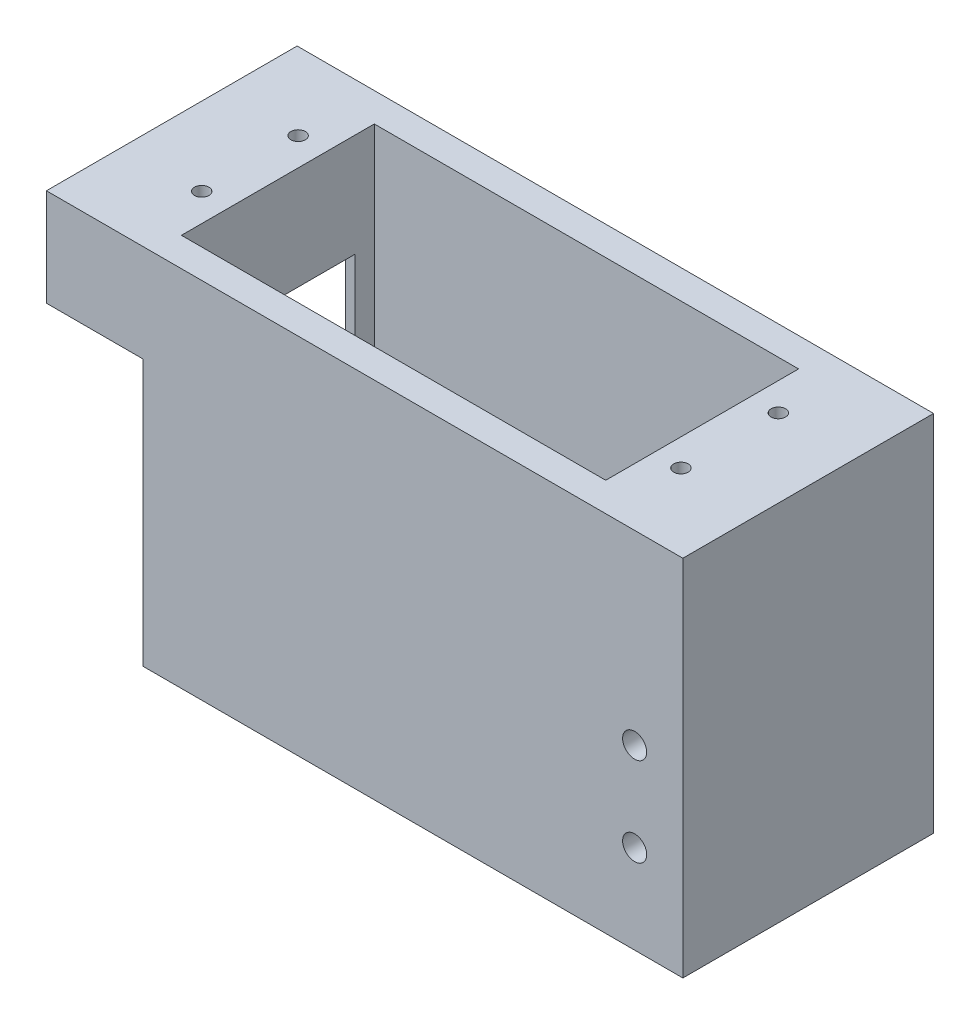
from build123d import *

# Parameters (mm, degrees)
SKETCH1_W                 = 46
SKETCH1_H                 = 26
BOSS_EXTRUDE1_DEPTH       = 27.6
SKETCH2_W                 = 66
SKETCH2_H                 = 26
BOSS_EXTRUDE2_DEPTH       = 10.1
SKETCH3_W                 = 40
SKETCH3_H                 = 20
CUT_EXTRUDE2_DEPTH        = 25.5
F_1_5MM_DOWEL_HOLE2_D     = 1.5
F_1_5MM_DOWEL_HOLE2_DEPTH = 9
F_1_5MM_DOWEL_HOLE2_TIP   = 0.450645464
SKETCH8_W                 = 40
SKETCH8_H                 = 20
CUT_EXTRUDE6_DEPTH        = 3
SKETCH7_W                 = 16
SKETCH7_H                 = 15
CUT_EXTRUDE8_DEPTH        = 3
SKETCH9_R                 = 10.9
CUT_EXTRUDE9_DEPTH        = 7
SKETCH10_W                = 44
SKETCH10_H                = 20
CUT_EXTRUDE10_DEPTH       = 28.5
SKETCH11_W                = 26
SKETCH11_H                = 27.6
BOSS_EXTRUDE3_DEPTH       = 10
F_2_5MM_DOWEL_HOLE1_D     = 2.5
F_2_5MM_DOWEL_HOLE1_DEPTH = 26
F_2_5MM_DOWEL_HOLE1_TIP   = 0.751075774
F_2_5MM_DOWEL_HOLE2_D     = 2.5
F_2_5MM_DOWEL_HOLE2_DEPTH = 9
F_2_5MM_DOWEL_HOLE2_TIP   = 0.751075774


with BuildPart() as part:
    # Sketch1 → Boss-Extrude1 (new body)
    with BuildSketch(Plane(origin=(0, 0, 0), x_dir=(1, 0, 0), z_dir=(0, 1, 0))):
        with Locations((23, 13)):
            Rectangle(SKETCH1_W, SKETCH1_H)
    extrude(amount=BOSS_EXTRUDE1_DEPTH)

    # Sketch2 → Boss-Extrude2 (add)
    with BuildSketch(Plane(origin=(0, 27.6, 0), x_dir=(1, 0, 0), z_dir=(0, 1, 0))):
        with Locations((23, 13)):
            Rectangle(SKETCH2_W, SKETCH2_H)
    extrude(amount=BOSS_EXTRUDE2_DEPTH)

    # Sketch3 → Cut-Extrude2 (cut)
    with BuildSketch(Plane(origin=(0, 37.7, 0), x_dir=(1, 0, 0), z_dir=(0, 1, 0))):
        with Locations((23, 13)):
            Rectangle(SKETCH3_W, SKETCH3_H)
    extrude(amount=-CUT_EXTRUDE2_DEPTH, mode=Mode.SUBTRACT)

    # Ø1.5mm Dowel Hole2
    with Locations(Plane(origin=(-1.9, 37.7, -18), x_dir=(0, 0, 1), z_dir=(0, 1, 0))):
        with Locations((0, 0), (10, 0), (10, 49.7), (0, 49.8)):
            Hole(F_1_5MM_DOWEL_HOLE2_D / 2, depth=F_1_5MM_DOWEL_HOLE2_DEPTH)
            with Locations((0, 0, -(F_1_5MM_DOWEL_HOLE2_DEPTH + F_1_5MM_DOWEL_HOLE2_TIP / 2))):  # 118° drill point
                Cone(0, F_1_5MM_DOWEL_HOLE2_D / 2, F_1_5MM_DOWEL_HOLE2_TIP, mode=Mode.SUBTRACT)

    # Sketch8 → Cut-Extrude6 (cut)
    with BuildSketch(Plane(origin=(0, 12.2, 0), x_dir=(1, 0, 0), z_dir=(0, 1, 0))):
        with Locations((23, 13)):
            Rectangle(SKETCH8_W, SKETCH8_H)
    extrude(amount=-CUT_EXTRUDE6_DEPTH, mode=Mode.SUBTRACT)

    # Sketch7 → Cut-Extrude8 (cut)
    with BuildSketch(Plane.ZY):
        with Locations((-13, 19.5)):
            Rectangle(SKETCH7_W, SKETCH7_H)
    extrude(amount=-CUT_EXTRUDE8_DEPTH, mode=Mode.SUBTRACT)

    # Sketch9 → Cut-Extrude9 (cut)
    with BuildSketch(Plane(origin=(0, 0, 0), x_dir=(-1, 0, 0), z_dir=(0, -1, 0))):
        with Locations(Location((-13.05, 13, 0), (0, 0, 90))):
            Circle(SKETCH9_R)
    extrude(amount=-CUT_EXTRUDE9_DEPTH, mode=Mode.SUBTRACT)

    # Sketch10 → Cut-Extrude10 (cut)
    with BuildSketch(Plane(origin=(0, 37.7, 0), x_dir=(1, 0, 0), z_dir=(0, 1, 0))):
        with Locations((23, 13)):
            Rectangle(SKETCH10_W, SKETCH10_H)
    extrude(amount=-CUT_EXTRUDE10_DEPTH, mode=Mode.SUBTRACT)

    # Sketch11 → Boss-Extrude3 (add)
    with BuildSketch(Plane(origin=(46, 0, 0), x_dir=(0, 0, -1), z_dir=(1, 0, 0))):
        with Locations((13, 13.8)):
            Rectangle(SKETCH11_W, SKETCH11_H)
    extrude(amount=BOSS_EXTRUDE3_DEPTH)

    # Ø2.5mm Dowel Hole1
    with Locations(Plane(origin=(51, 18.4, 0), x_dir=(1, 0, 0), z_dir=(0, 0, 1))):
        with Locations((0, 0), (0, -9.2)):
            Hole(F_2_5MM_DOWEL_HOLE1_D / 2, depth=F_2_5MM_DOWEL_HOLE1_DEPTH)
            with Locations((0, 0, -(F_2_5MM_DOWEL_HOLE1_DEPTH + F_2_5MM_DOWEL_HOLE1_TIP / 2))):  # 118° drill point
                Cone(0, F_2_5MM_DOWEL_HOLE1_D / 2, F_2_5MM_DOWEL_HOLE1_TIP, mode=Mode.SUBTRACT)

    # Ø2.5mm Dowel Hole2
    with Locations(Plane.XZ):
        with Locations((51, -13)):
            Hole(F_2_5MM_DOWEL_HOLE2_D / 2, depth=F_2_5MM_DOWEL_HOLE2_DEPTH)
            with Locations((0, 0, -(F_2_5MM_DOWEL_HOLE2_DEPTH + F_2_5MM_DOWEL_HOLE2_TIP / 2))):  # 118° drill point
                Cone(0, F_2_5MM_DOWEL_HOLE2_D / 2, F_2_5MM_DOWEL_HOLE2_TIP, mode=Mode.SUBTRACT)


solid = part.part
